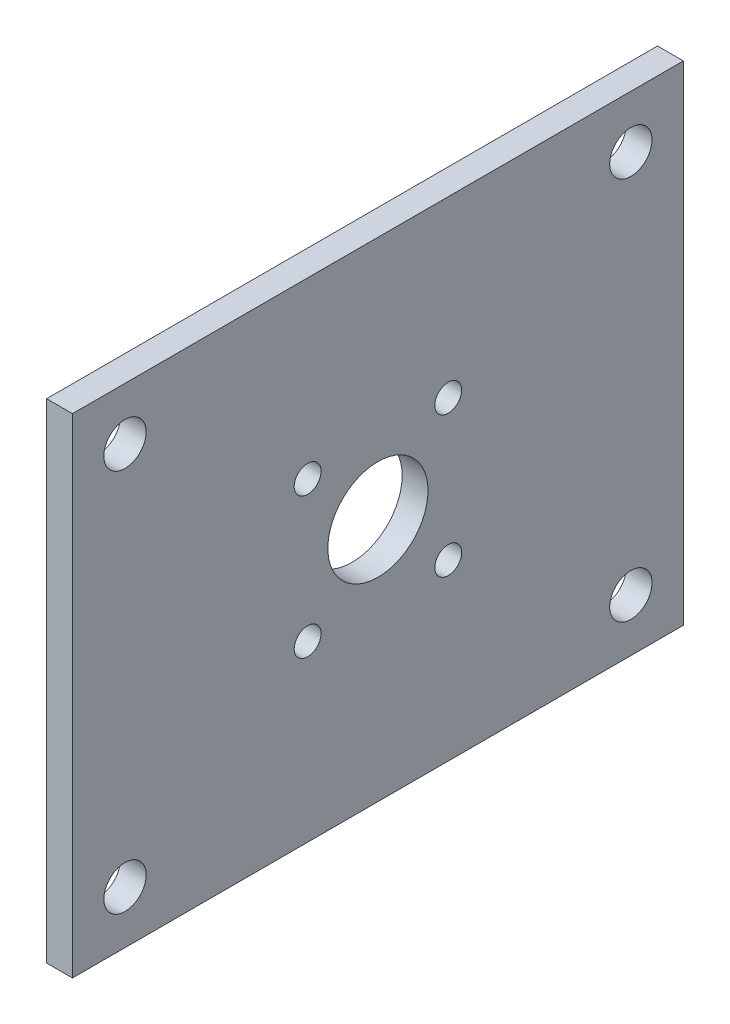
from build123d import *

# Parameters (mm, degrees)
BOSS_EXTRUDE1_DEPTH      = 1.5875
BOSS_EXTRUDE1_DEPTH_BACK = 1.5875
SKETCH1_W                = 75
SKETCH1_H                = 60
CUT_EXTRUDE1_DEPTH       = 49.049663435
CUT_EXTRUDE1_DEPTH_BACK  = 49.049663435
SKETCH2_R                = 2.6
CUT_EXTRUDE2_DEPTH       = 49.049663435
CUT_EXTRUDE2_DEPTH_BACK  = 49.049663435
SKETCH3_R                = 6.15
SKETCH3_R_2              = 1.65


with BuildPart() as part:
    # Sketch1 → Boss-Extrude1 (new, two sides: drawn at the far end of the back side and taken through both)
    with BuildSketch(Plane(origin=(0, 0, 0), x_dir=(0, 0, -1), z_dir=(1, 0, 0)).offset(-BOSS_EXTRUDE1_DEPTH_BACK)):
        Rectangle(SKETCH1_W, SKETCH1_H)
    extrude(amount=BOSS_EXTRUDE1_DEPTH + BOSS_EXTRUDE1_DEPTH_BACK)

    # Sketch2 → Cut-Extrude1 (cut, two sides: drawn at the far end of the back side and taken through both)
    with BuildSketch(Plane(origin=(0, 0, 0), x_dir=(0, 0, -1), z_dir=(1, 0, 0)).offset(-CUT_EXTRUDE1_DEPTH_BACK)):
        with Locations((-31.05, 23.55)):
            Circle(SKETCH2_R)
        with Locations((31.05, 23.55)):
            Circle(SKETCH2_R)
        with Locations((31.05, -23.55)):
            Circle(SKETCH2_R)
        with Locations((-31.05, -23.55)):
            Circle(SKETCH2_R)
    extrude(amount=CUT_EXTRUDE1_DEPTH + CUT_EXTRUDE1_DEPTH_BACK, mode=Mode.SUBTRACT)

    # Sketch3 → Cut-Extrude2 (cut, two sides: drawn at the far end of the back side and taken through both)
    with BuildSketch(Plane(origin=(0, 0, 0), x_dir=(0, 0, -1), z_dir=(1, 0, 0)).offset(-CUT_EXTRUDE2_DEPTH_BACK)):
        Circle(SKETCH3_R)
        with Locations((-8.63, 8.63)):
            Circle(SKETCH3_R_2)
        with Locations((-8.63, -8.63)):
            Circle(SKETCH3_R_2)
        with Locations((8.63, -8.63)):
            Circle(SKETCH3_R_2)
        with Locations((8.63, 8.63)):
            Circle(SKETCH3_R_2)
    extrude(amount=CUT_EXTRUDE2_DEPTH + CUT_EXTRUDE2_DEPTH_BACK, mode=Mode.SUBTRACT)


solid = part.part
